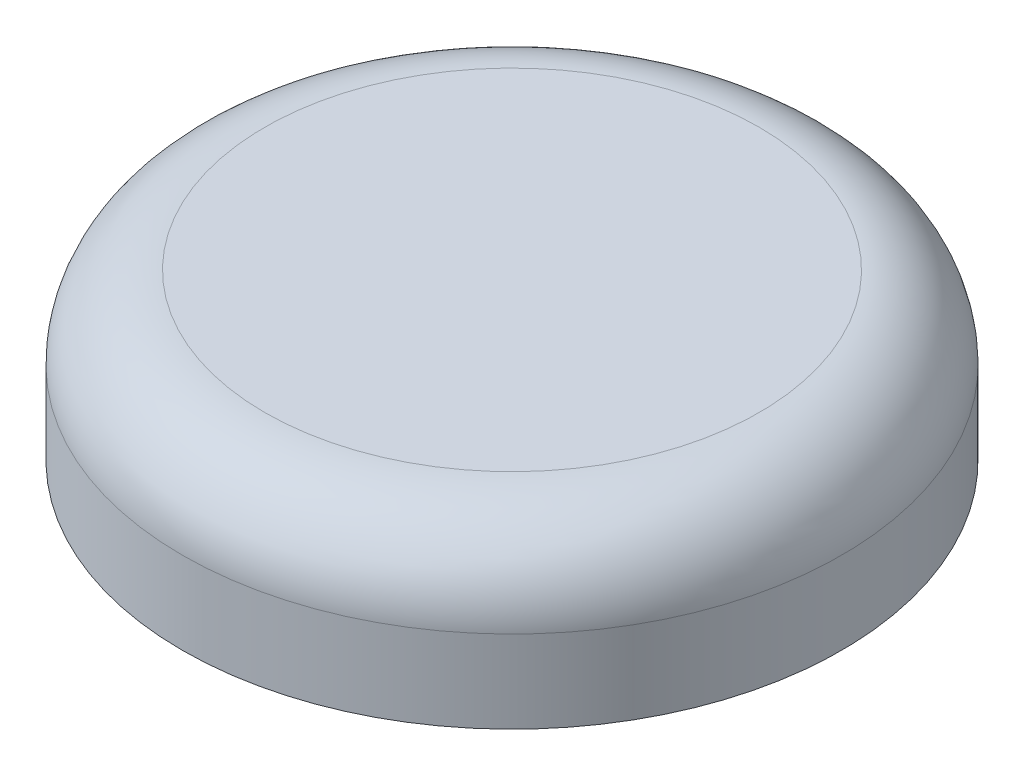
from build123d import *

# Parameters (mm, degrees)
SKETCH1_R           = 20
BOSS_EXTRUDE1_DEPTH = 10
FILLET1_R           = 5
SKETCH2_R           = 10
CUT_EXTRUDE1_DEPTH  = 5


with BuildPart() as part:
    # Sketch1 → Boss-Extrude1 (new body)
    with BuildSketch(Plane(origin=(0, 0, 0), x_dir=(1, 0, 0), z_dir=(0, 1, 0))):
        with Locations(Location((0, 0, 0), (0, 0, 270))):
            Circle(SKETCH1_R)
    extrude(amount=BOSS_EXTRUDE1_DEPTH)

    # Fillet1
    fillet1_edges = [part.edges().sort_by_distance(p)[0] for p in [
        (0, 10, -20),
    ]]
    fillet(fillet1_edges, radius=FILLET1_R)

    # Sketch2 → Cut-Extrude1 (cut)
    with BuildSketch(Plane.XZ):
        with Locations(Location((0, 0, 0), (0, 0, 270))):
            Circle(SKETCH2_R)
    extrude(amount=-CUT_EXTRUDE1_DEPTH, mode=Mode.SUBTRACT)


solid = part.part
